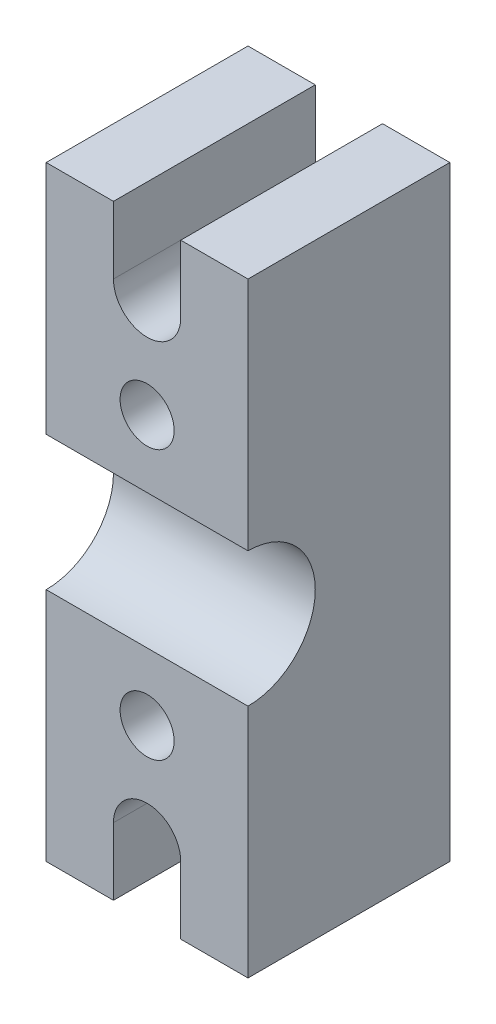
from build123d import *

# Parameters (mm, degrees)
BOSS_EXTRUDE1_DEPTH         = 19.05
F_1_4_20_TAPPED_HOLE1_D     = 5.1054
F_1_4_20_TAPPED_HOLE1_DEPTH = 16.51
F_1_4_20_TAPPED_HOLE1_TIP   = 1.533816902
SKETCH4_R                   = 6.35
CUT_EXTRUDE1_DEPTH          = 19.05


with BuildPart() as part:
    # Sketch1 → Boss-Extrude1 (new body)
    with BuildSketch(Plane.XY):
        with BuildLine():
            Line((-3.175, -28.575), (-3.175, -22.225))
            ThreePointArc((-3.175, -22.225), (0, -19.05), (3.175, -22.225))
            Line((3.175, -22.225), (3.175, -28.575))
            Line((3.175, -28.575), (9.525, -28.575))
            Line((9.525, -28.575), (9.525, 28.575))
            Line((9.525, 28.575), (3.175, 28.575))
            Line((3.175, 28.575), (3.175, 22.225))
            ThreePointArc((3.175, 22.225), (0, 19.05), (-3.175, 22.225))
            Line((-3.175, 22.225), (-3.175, 28.575))
            Line((-3.175, 28.575), (-9.525, 28.575))
            Line((-9.525, 28.575), (-9.525, -28.575))
            Line((-9.525, -28.575), (-3.175, -28.575))
        make_face()
    extrude(amount=BOSS_EXTRUDE1_DEPTH)

    # 1/4-20 Tapped Hole1
    with Locations(Plane.XY.offset(19.05)):
        with Locations((0, 12.7), (0, -12.7)):
            Hole(F_1_4_20_TAPPED_HOLE1_D / 2, depth=F_1_4_20_TAPPED_HOLE1_DEPTH)
            with Locations((0, 0, -(F_1_4_20_TAPPED_HOLE1_DEPTH + F_1_4_20_TAPPED_HOLE1_TIP / 2))):  # 118° drill point
                Cone(0, F_1_4_20_TAPPED_HOLE1_D / 2, F_1_4_20_TAPPED_HOLE1_TIP, mode=Mode.SUBTRACT)

    # Sketch4 → Cut-Extrude1 (cut)
    with BuildSketch(Plane(origin=(9.525, 0, 0), x_dir=(0, 0, -1), z_dir=(1, 0, 0))):
        with Locations((-19.05, 0)):
            Circle(SKETCH4_R)
    extrude(amount=-CUT_EXTRUDE1_DEPTH, mode=Mode.SUBTRACT)


solid = part.part
